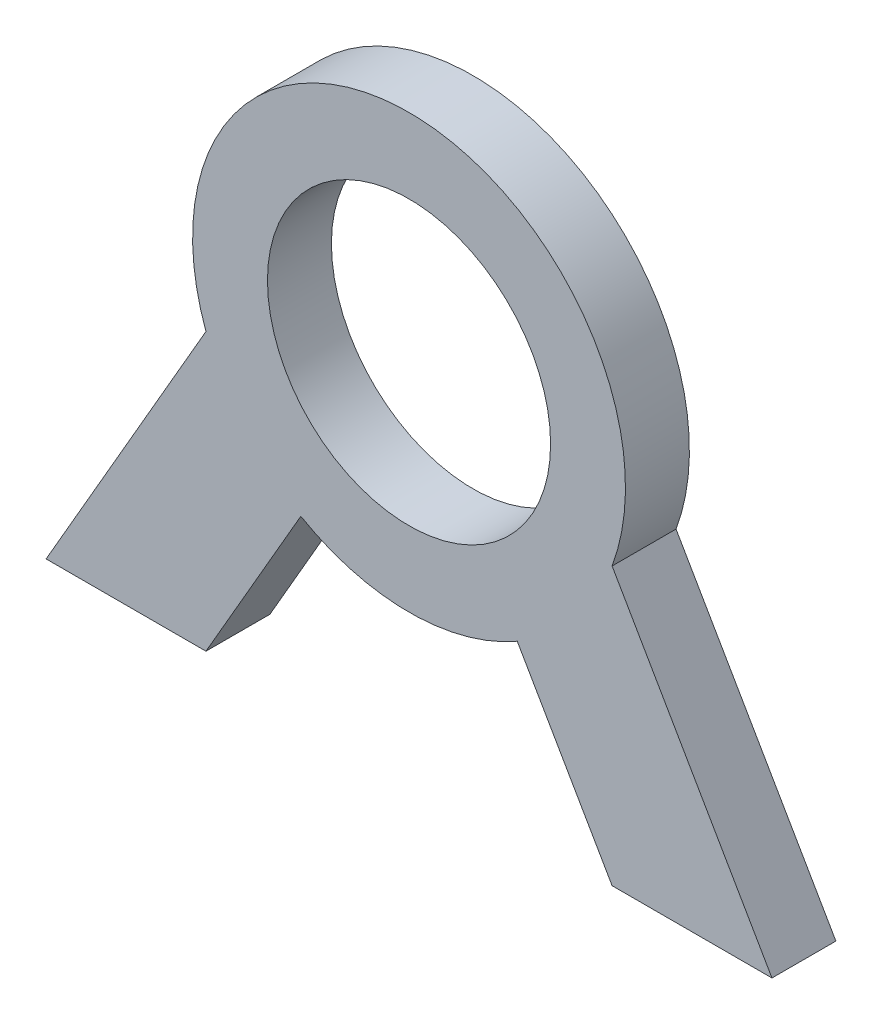
from build123d import *

# Parameters (mm, degrees)
SKETCH1_R           = 11.24712
BOSS_EXTRUDE2_DEPTH = 5.08


with BuildPart() as part:
    # Sketch1 → Boss-Extrude2 (new body)
    with BuildSketch(Plane.XY):
        with BuildLine():
            Line((-16.134114125, 0), (-8.597805797, 13.053268926))
            ThreePointArc((-8.597805797, 13.053268926), (0, 10.749493806), (8.597805797, 13.053268926))
            Line((8.597805797, 13.053268926), (16.134114125, 0))
            Line((16.134114125, 0), (28.834114125, 0))
            Line((28.834114125, 0), (16.134114125, 21.997045256))
            ThreePointArc((16.134114125, 21.997045256), (0, 45.140716994), (-16.134114125, 21.997045256))
            Line((-16.134114125, 21.997045256), (-28.834114125, 0))
            Line((-28.834114125, 0), (-16.134114125, 0))
        make_face()
        with Locations((0, 27.9451054)):
            Circle(SKETCH1_R, mode=Mode.SUBTRACT)
    extrude(amount=BOSS_EXTRUDE2_DEPTH)


solid = part.part
